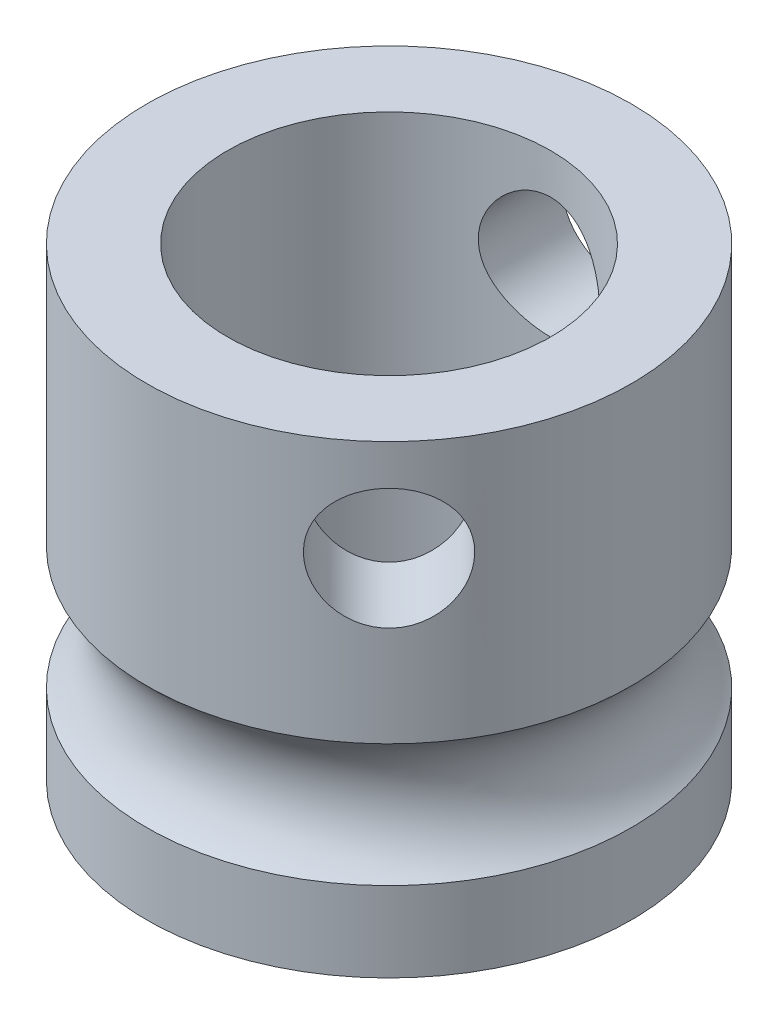
from build123d import *

# Parameters (mm, degrees)
SKETCH3_R          = 1.5
CUT_EXTRUDE1_DEPTH = 12.66190379
CIRPATTERN1_COUNT  = 2
CIRPATTERN1_ANGLE  = 135
CUT_EXTRUDE2_START = -0.5
SKETCH4_R          = 6
CUT_EXTRUDE2_DEPTH = 0.5


with BuildPart() as part:
    # Sketch2 → Revolve1 (revolve)
    with BuildSketch(Plane.XY):
        with BuildLine():
            Line((6, 8), (4, 8))
            Line((4, 8), (4, -4))
            Line((4, -4), (6, -4))
            Line((6, -4), (6, -1.519868415))
            ThreePointArc((6, -1.519868415), (5.3, 0), (6, 1.519868415))
            Line((6, 1.519868415), (6, 4))
            Line((6, 4), (6, 8))
        make_face()
    revolve(axis=Axis((0, 0, 0), (0, 1, 0)))

    # Sketch3 → Cut-Extrude1 (cut, through all)
    with BuildSketch(Plane.XY):
        with Locations((0, 5.5)):
            Circle(SKETCH3_R)
    cut_extrude1 = extrude(amount=-CUT_EXTRUDE1_DEPTH, mode=Mode.SUBTRACT)

    # CirPattern1: Cut-Extrude1 ×2 about axis
    cirpattern1_axis = Axis((0, 8, 0), (0, -1, 0))
    for i in range(1, CIRPATTERN1_COUNT):
        add(cut_extrude1.rotate(cirpattern1_axis, i * CIRPATTERN1_ANGLE / (CIRPATTERN1_COUNT - 1)), mode=Mode.SUBTRACT)

    # Sketch4 → Cut-Extrude2 (cut)
    with BuildSketch(Plane.XZ.offset(4).offset(CUT_EXTRUDE2_START)):
        Circle(SKETCH4_R)
    extrude(amount=CUT_EXTRUDE2_DEPTH, mode=Mode.SUBTRACT)


solid = part.part
